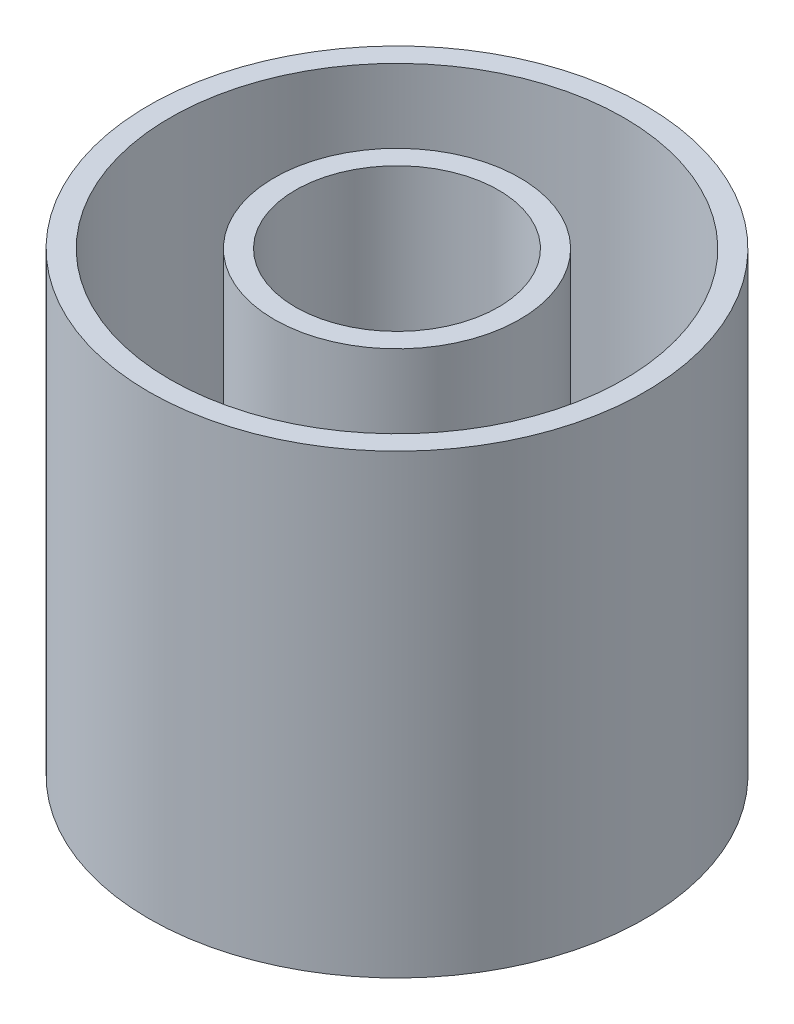
from build123d import *

# Parameters (mm, degrees)
SKETCH1_R            = 11.6459
MAIN_EXTRUSION_DEPTH = 21.4122
SKETCH2_R            = 4.7625
ID_BORE_DEPTH        = 20
SKETCH3_R            = 10.6459
SKETCH3_R_2          = 5.7625
SEAL_RECESS_DEPTH    = 20.4122


with BuildPart() as part:
    # Sketch1 → main extrusion (new body)
    with BuildSketch(Plane(origin=(0, 0, 0), x_dir=(1, 0, 0), z_dir=(0, 1, 0))):
        with Locations(Location((0, 0, 0), (0, 0, 270))):
            Circle(SKETCH1_R)
    extrude(amount=MAIN_EXTRUSION_DEPTH)

    # Sketch2 → ID bore (cut)
    with BuildSketch(Plane(origin=(0, 21.4122, 0), x_dir=(1, 0, 0), z_dir=(0, 1, 0))):
        with Locations(Location((0, 0, 0), (0, 0, 270))):
            Circle(SKETCH2_R)
    extrude(amount=-ID_BORE_DEPTH, mode=Mode.SUBTRACT)

    # Sketch3 → seal recess (cut)
    with BuildSketch(Plane(origin=(0, 21.4122, 0), x_dir=(1, 0, 0), z_dir=(0, 1, 0))):
        with Locations(Location((0, 0, 0), (0, 0, 270))):
            Circle(SKETCH3_R)
        with Locations(Location((0, 0, 0), (0, 0, 270))):
            Circle(SKETCH3_R_2, mode=Mode.SUBTRACT)
    extrude(amount=-SEAL_RECESS_DEPTH, mode=Mode.SUBTRACT)


solid = part.part
